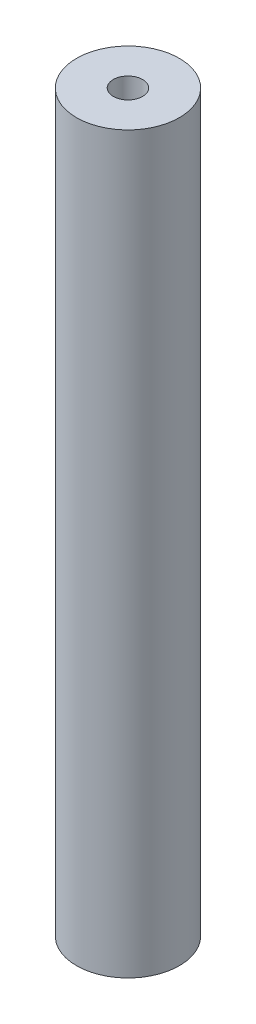
from build123d import *

# Parameters (mm, degrees)
SKETCH1_R           = 8.75
BOSS_EXTRUDE1_DEPTH = 125
SKETCH2_R           = 2.5
CUT_EXTRUDE1_DEPTH  = 131


with BuildPart() as part:
    # Sketch1 → Boss-Extrude1 (new body)
    with BuildSketch(Plane(origin=(0, 0, 0), x_dir=(1, 0, 0), z_dir=(0, 1, 0))):
        with Locations(Location((0, 0, 0), (0, 0, 270))):
            Circle(SKETCH1_R)
    extrude(amount=BOSS_EXTRUDE1_DEPTH)

    # Sketch2 → Cut-Extrude1 (cut)
    with BuildSketch(Plane(origin=(0, 0, 0), x_dir=(1, 0, 0), z_dir=(0, 1, 0))):
        with Locations(Location((0, 0, 0), (0, 0, 270))):
            Circle(SKETCH2_R)
    extrude(amount=CUT_EXTRUDE1_DEPTH, mode=Mode.SUBTRACT)


solid = part.part
